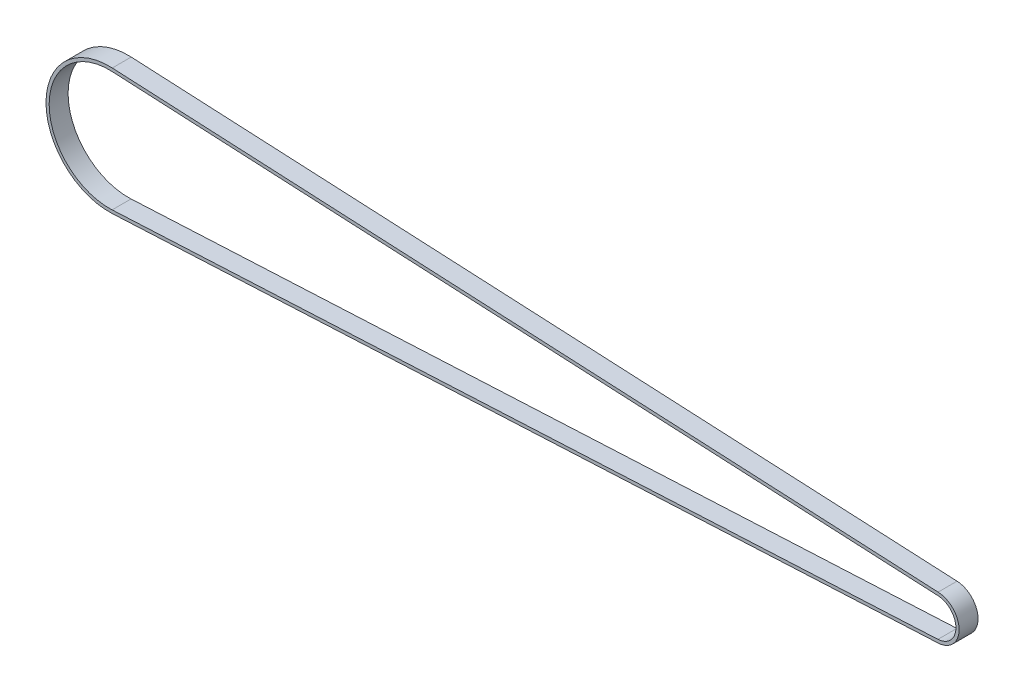
from build123d import *

# Parameters (mm, degrees)
BOSS_EXTRUDE1_DEPTH = 6


with BuildPart() as part:
    # Sketch1 → Boss-Extrude1 (new body)
    with BuildSketch(Plane.XY):
        with BuildLine():
            Line((-65.827683703, 19.975415073), (195.794174427, 6.991395275))
            ThreePointArc((195.794174427, 6.991395275), (202.447198776, 0), (195.794174427, -6.991395275))
            Line((195.794174427, -6.991395275), (-65.827683703, -19.975415073))
            ThreePointArc((-65.827683703, -19.975415073), (-86.819042707, 0), (-65.827683703, 19.975415073))
        make_face()
        with BuildLine():
            Line((195.744606477, 5.992624522), (-65.877251653, 18.976644319))
            ThreePointArc((-65.877251653, 18.976644319), (-85.819042707, 0), (-65.877251653, -18.976644319))
            Line((-65.877251653, -18.976644319), (195.744606477, -5.992624522))
            ThreePointArc((195.744606477, -5.992624522), (201.447198776, 0), (195.744606477, 5.992624522))
        make_face(mode=Mode.SUBTRACT)
    extrude(amount=BOSS_EXTRUDE1_DEPTH)


solid = part.part
